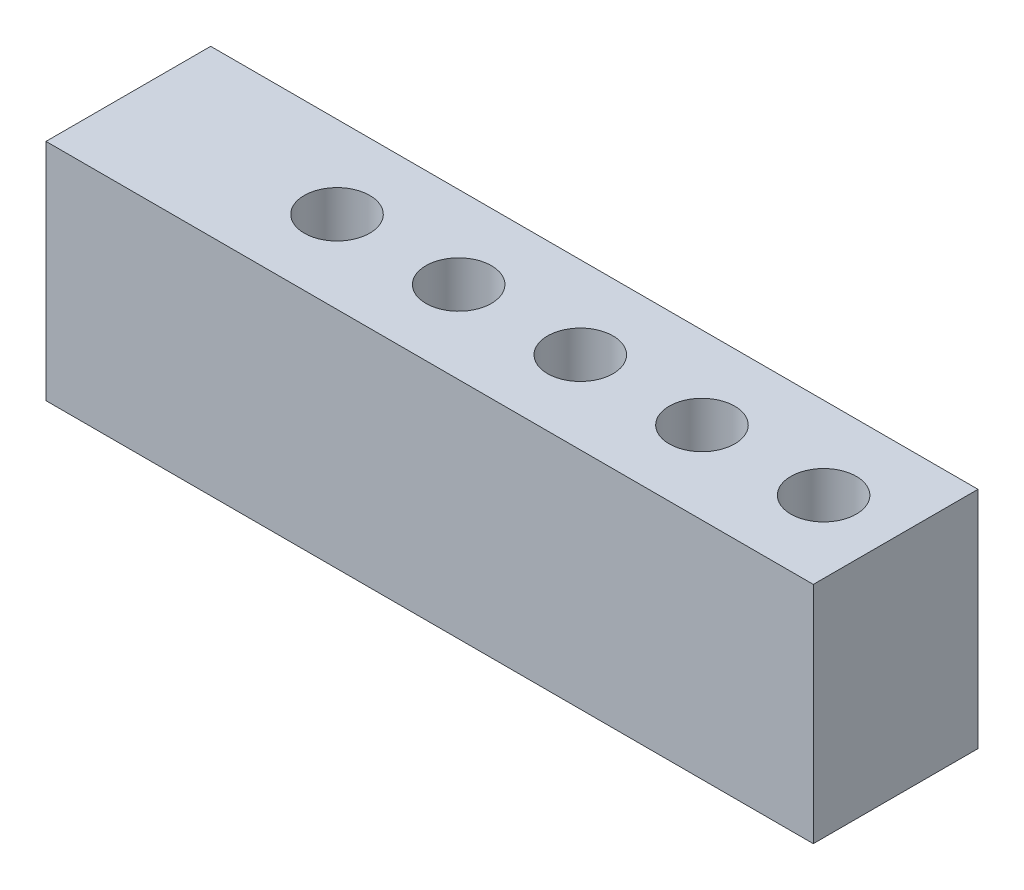
from build123d import *

# Parameters (mm, degrees)
SKETCH4_W               = 22.352
SKETCH4_H               = 30.48
BOSS_EXTRUDE2_DEPTH     = 104.14
CUT_EXTRUDE2_START      = -100.33
SKETCH5_R               = 5.08
CUT_EXTRUDE2_DEPTH      = 100.33
CUT_EXTRUDE5_REACH      = 111.083
CUT_EXTRUDE5_END_RADIUS = 5.08
SKETCH9_R               = 4.445
LPATTERN1_COUNT         = 5
LPATTERN1_PITCH         = 16.51
SKETCH14_R              = 7.14375
CUT_EXTRUDE7_DEPTH      = 20.066


with BuildPart() as part:
    # Sketch4 → Boss-Extrude2 (new body)
    with BuildSketch(Plane(origin=(0, 0, 0), x_dir=(0, 0, -1), z_dir=(1, 0, 0))):
        Rectangle(SKETCH4_W, SKETCH4_H)
    extrude(amount=BOSS_EXTRUDE2_DEPTH)

    # Sketch5 → Cut-Extrude2 (cut)
    with BuildSketch(Plane.ZY.offset(CUT_EXTRUDE2_START)):
        with Locations((0, -1.9939)):
            Circle(SKETCH5_R)
    extrude(amount=CUT_EXTRUDE2_DEPTH, mode=Mode.SUBTRACT)

    # Cut-Extrude5: up to this cylinder (the profile starts outside it)
    cut_extrude5_end = Plane(origin=(28.321, -1.9939, 0), z_dir=(-1, 0, 0)) * Cylinder(CUT_EXTRUDE5_END_RADIUS, 233.326, mode=Mode.PRIVATE)
    # Sketch9 → Cut-Extrude5 (cut, up to the surface)
    with BuildSketch(Plane(origin=(0, 15.24, 0), x_dir=(1, 0, 0), z_dir=(0, 1, 0)), mode=Mode.PRIVATE) as cut_extrude5_sk1:
        with Locations(Location((28.321, 0, 0), (0, 0, 270))):
            Circle(SKETCH9_R)
    cut_extrude5_tool1 = extrude(cut_extrude5_sk1.sketch, amount=-CUT_EXTRUDE5_REACH, mode=Mode.PRIVATE) - cut_extrude5_end
    cut_extrude5 = cut_extrude5_tool1.solids().sort_by_distance((28.321, 15.24, 0))[0]
    add(cut_extrude5, mode=Mode.SUBTRACT)

    # LPattern1: Cut-Extrude5 ×5
    with Locations(*[(i * LPATTERN1_PITCH, 0, 0) for i in range(1, LPATTERN1_COUNT)]):
        add(cut_extrude5, mode=Mode.SUBTRACT)

    # Sketch14 → Cut-Extrude7 (cut)
    with BuildSketch(Plane.ZY):
        with Locations((0, -1.9939)):
            Circle(SKETCH14_R)
    extrude(amount=-CUT_EXTRUDE7_DEPTH, mode=Mode.SUBTRACT)


solid = part.part
